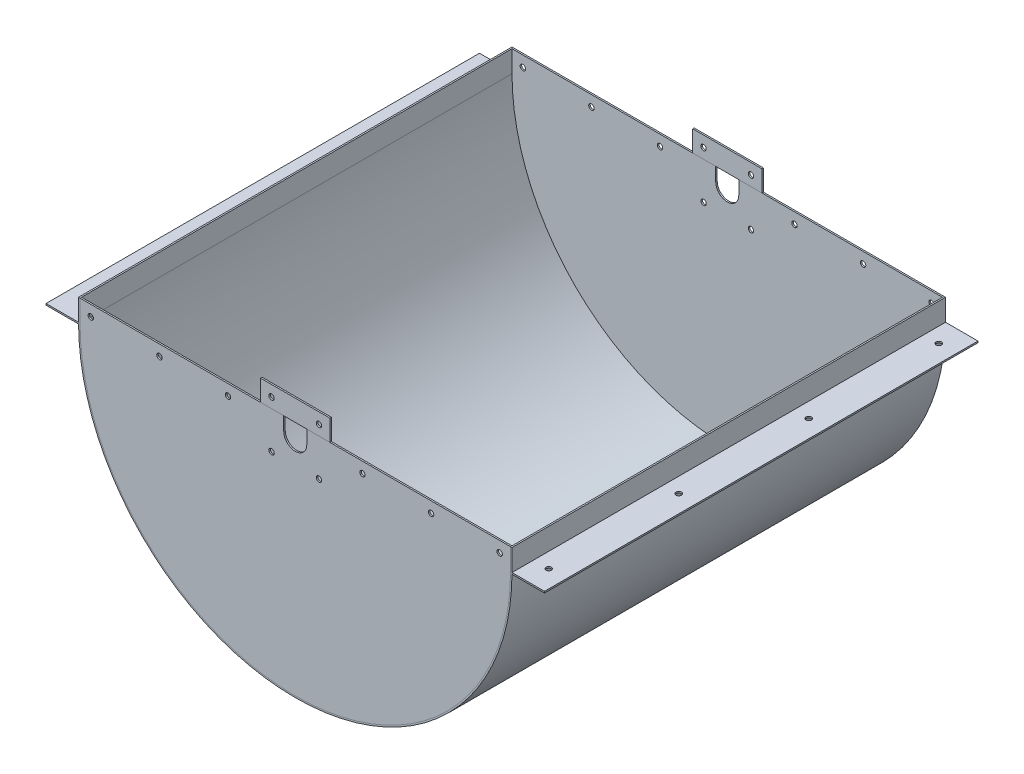
from build123d import *

# Parameters (mm, degrees)
RESSALTO_EXTRUS_O1_DEPTH = 508
RESSALTO_EXTRUS_O2_DEPTH = 3.5
ESBO_O3_R                = 6.35
CORTE_EXTRUS_O1_DEPTH    = 3.5
ESBO_O4_W                = 161.925
ESBO_O4_H                = 49.1998
RESSALTO_EXTRUS_O3_DEPTH = 3.5
ESBO_O6_R                = 6.35
CORTE_EXTRUS_O2_DEPTH    = 3.5
ESBO_O7_W                = 76.2
ESBO_O7_H                = 1016
RESSALTO_EXTRUS_O4_DEPTH = 3.5
ESBO_O8_R                = 6.35
ESBO_O8_R_2              = 6.351024484
CORTE_EXTRUS_O3_DEPTH    = 3.5


with BuildPart() as part:
    # Esboço1 → Ressalto-extrusão1 (new, symmetric)
    with BuildSketch(Plane.XY):
        with BuildLine():
            Line((-504.5, 0), (-504.5, 50.8))
            Line((-504.5, 50.8), (-508, 50.8))
            Line((-508, 50.8), (-508, 0))
            ThreePointArc((-508, 0), (0, -508), (508, 0))
            Line((508, 0), (508, 50.8))
            Line((508, 50.8), (504.5, 50.8))
            Line((504.5, 50.8), (504.5, 0))
            ThreePointArc((504.5, 0), (0, -504.5), (-504.5, 0))
        make_face()
    extrude(amount=RESSALTO_EXTRUS_O1_DEPTH, both=True)


with BuildPart() as body_2:
    # Esboço2 → Ressalto-extrusão2 (new body)
    with BuildSketch(Plane.XY.offset(508)):
        with BuildLine():
            Line((504.5, 50.8), (504.5, 0))
            ThreePointArc((504.5, 0), (0, -504.5), (-504.5, 0))
            Line((-504.5, 0), (-504.5, 50.8))
            Line((-504.5, 50.8), (504.5, 50.8))
        make_face()
    extrude(amount=-RESSALTO_EXTRUS_O2_DEPTH)

    # Esboço3 → Corte-extrusão1 (cut)
    with BuildSketch(Plane.XY.offset(508)):
        with Locations((-479.1, 25.4)):
            Circle(ESBO_O3_R)
        with Locations((-318.318, 25.4)):
            Circle(ESBO_O3_R)
        with Locations((-157.536, 25.4)):
            Circle(ESBO_O3_R)
        with Locations((157.536, 25.4)):
            Circle(ESBO_O3_R)
        with Locations((318.318, 25.4)):
            Circle(ESBO_O3_R)
        with Locations((479.1, 25.4)):
            Circle(ESBO_O3_R)
        with BuildLine():
            Line((27, 19.05), (27, 50.8))
            Line((27, 50.8), (-27, 50.8))
            Line((-27, 50.8), (-27, 19.05))
            ThreePointArc((-27, 19.05), (0, -7.95), (27, 19.05))
        make_face()
    extrude(amount=-CORTE_EXTRUS_O1_DEPTH, mode=Mode.SUBTRACT)


with BuildPart() as body_3:
    # Esboço4 → Ressalto-extrusão3 (new body)
    with BuildSketch(Plane.XY.offset(508)):
        with Locations((0, 75.3999)):
            Rectangle(ESBO_O4_W, ESBO_O4_H)
    extrude(amount=-RESSALTO_EXTRUS_O3_DEPTH)


with BuildPart() as corte_extrus_o2_tool:
    # Esboço6 → Corte-extrusão2 (new body)
    with BuildSketch(Plane.XY.offset(508)):
        with Locations((-55.562329545, 74.612329545)):
            Circle(ESBO_O6_R)
        with Locations((55.562329545, 74.612329545)):
            Circle(ESBO_O6_R)
        with Locations((55.562329545, -36.512329545)):
            Circle(ESBO_O6_R)
        with Locations((-55.562329545, -36.512329545)):
            Circle(ESBO_O6_R)
    extrude(amount=-CORTE_EXTRUS_O2_DEPTH)


with BuildPart() as body_2_1:
    add(body_2.part)

    # Corte-extrusão2: cut by corte_extrus_o2_tool
    add(corte_extrus_o2_tool.part, mode=Mode.SUBTRACT)


with BuildPart() as body_3_1:
    add(body_3.part)

    # Corte-extrusão2: cut by corte_extrus_o2_tool
    add(corte_extrus_o2_tool.part, mode=Mode.SUBTRACT)


with BuildPart() as body_4:
    # Espelhar1: mirrored copy
    add(body_2_1.part.mirror(Plane.XY))


with BuildPart() as body_5:
    # Espelhar1 2: mirrored copy
    add(body_3_1.part.mirror(Plane.XY))


with BuildPart() as body_6:
    # Esboço7 → Ressalto-extrusão4 (new body)
    with BuildSketch(Plane(origin=(0, 0, 0), x_dir=(1, 0, 0), z_dir=(0, 1, 0))):
        with Locations((546.1, 0)):
            Rectangle(ESBO_O7_W, ESBO_O7_H)
    extrude(amount=-RESSALTO_EXTRUS_O4_DEPTH)


with BuildPart() as body_7:
    # Espelhar2: mirrored copy
    add(body_6.part.mirror(Plane(origin=(0, 0, 0), x_dir=(0, 0, 1), z_dir=(1, 0, 0))))


with BuildPart() as corte_extrus_o3_tool:
    # Esboço8 → Corte-extrusão3 (new body)
    with BuildSketch(Plane(origin=(0, 0, 0), x_dir=(1, 0, 0), z_dir=(0, 1, 0))):
        with Locations(Location((-543.25, -457.2, 0), (0, 0, 270))):
            Circle(ESBO_O8_R)
        with Locations(Location((-543.25, -152.401024484, 0), (0, 0, 270))):
            Circle(ESBO_O8_R_2)
        with Locations(Location((-543.25, 152.401024484, 0), (0, 0, 270))):
            Circle(ESBO_O8_R_2)
        with Locations(Location((-543.25, 457.2, 0), (0, 0, 270))):
            Circle(ESBO_O8_R)
        with Locations(Location((543.25, 457.2, 0), (0, 0, 90))):
            Circle(ESBO_O8_R)
        with Locations(Location((543.25, 152.401024484, 0), (0, 0, 90))):
            Circle(ESBO_O8_R_2)
        with Locations(Location((543.25, -152.401024484, 0), (0, 0, 90))):
            Circle(ESBO_O8_R_2)
        with Locations(Location((543.25, -457.2, 0), (0, 0, 90))):
            Circle(ESBO_O8_R)
    extrude(amount=-CORTE_EXTRUS_O3_DEPTH)


with BuildPart() as body_6_1:
    add(body_6.part)

    # Corte-extrusão3: cut by corte_extrus_o3_tool
    add(corte_extrus_o3_tool.part, mode=Mode.SUBTRACT)


with BuildPart() as body_7_1:
    add(body_7.part)

    # Corte-extrusão3: cut by corte_extrus_o3_tool
    add(corte_extrus_o3_tool.part, mode=Mode.SUBTRACT)


solid = Compound([part.part, body_2_1.part, body_3_1.part, body_4.part, body_5.part, body_6_1.part, body_7_1.part])
